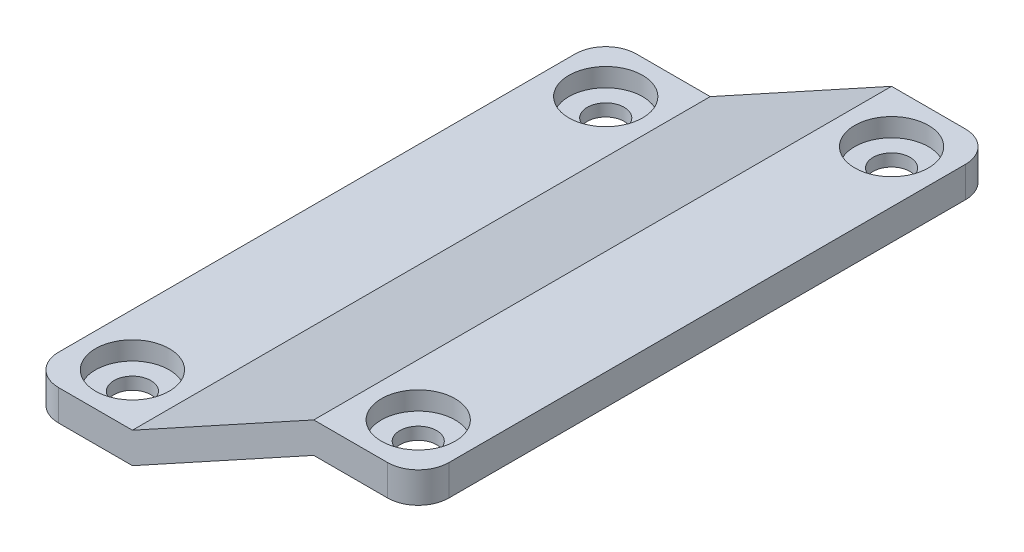
from build123d import *

# Parameters (mm, degrees)
COVER_BODY_DEPTH                        = 94
CBORE_FOR_M6_HEX_HEAD_BOLT1_D           = 6
CBORE_FOR_M6_HEX_HEAD_BOLT1_CBORE_D     = 12
CBORE_FOR_M6_HEX_HEAD_BOLT1_CBORE_DEPTH = 3
CBORE_FOR_M6_HEX_HEAD_BOLT2_D           = 6
CBORE_FOR_M6_HEX_HEAD_BOLT2_CBORE_D     = 12
CBORE_FOR_M6_HEX_HEAD_BOLT2_CBORE_DEPTH = 3
FILLET1_R                               = 5


with BuildPart() as part:
    # Sketch1 → Cover Body (new body)
    with BuildSketch(Plane.XY):
        Polygon((-15.007754177, -4.568983292), (14.492245823, 11.631016708), (31.492245823, 11.631016708), (31.492245823, 6.631016708), (14.492245823, 6.631016708), (-15.007754177, -9.568983292), (-32.007754177, -9.568983292), (-32.007754177, -4.568983292), align=None)
    extrude(amount=-COVER_BODY_DEPTH)

    # CBORE for M6 Hex Head Bolt1 (through all)
    with Locations(Plane(origin=(0, -4.568983292, 0), x_dir=(1, 0, 0), z_dir=(0, 1, 0))):
        with Locations((-23.507754177, 85.5), (-23.507754177, 8.5)):
            CounterBoreHole(CBORE_FOR_M6_HEX_HEAD_BOLT1_D / 2, CBORE_FOR_M6_HEX_HEAD_BOLT1_CBORE_D / 2, CBORE_FOR_M6_HEX_HEAD_BOLT1_CBORE_DEPTH)

    # CBORE for M6 Hex Head Bolt2 (through all)
    with Locations(Plane(origin=(0, 11.631016708, 0), x_dir=(1, 0, 0), z_dir=(0, 1, 0))):
        with Locations((22.992245823, 8.5), (22.992245823, 85.5)):
            CounterBoreHole(CBORE_FOR_M6_HEX_HEAD_BOLT2_D / 2, CBORE_FOR_M6_HEX_HEAD_BOLT2_CBORE_D / 2, CBORE_FOR_M6_HEX_HEAD_BOLT2_CBORE_DEPTH)

    # Fillet1
    fillet1_edges = [part.edges().sort_by_distance(p)[0] for p in [
        (31.492245823, 9.131016708, 0),
        (31.492245823, 9.131016708, -94),
        (-32.007754177, -7.068983292, -94),
        (-32.007754177, -7.068983292, 0),
    ]]
    fillet(fillet1_edges, radius=FILLET1_R)


solid = part.part
